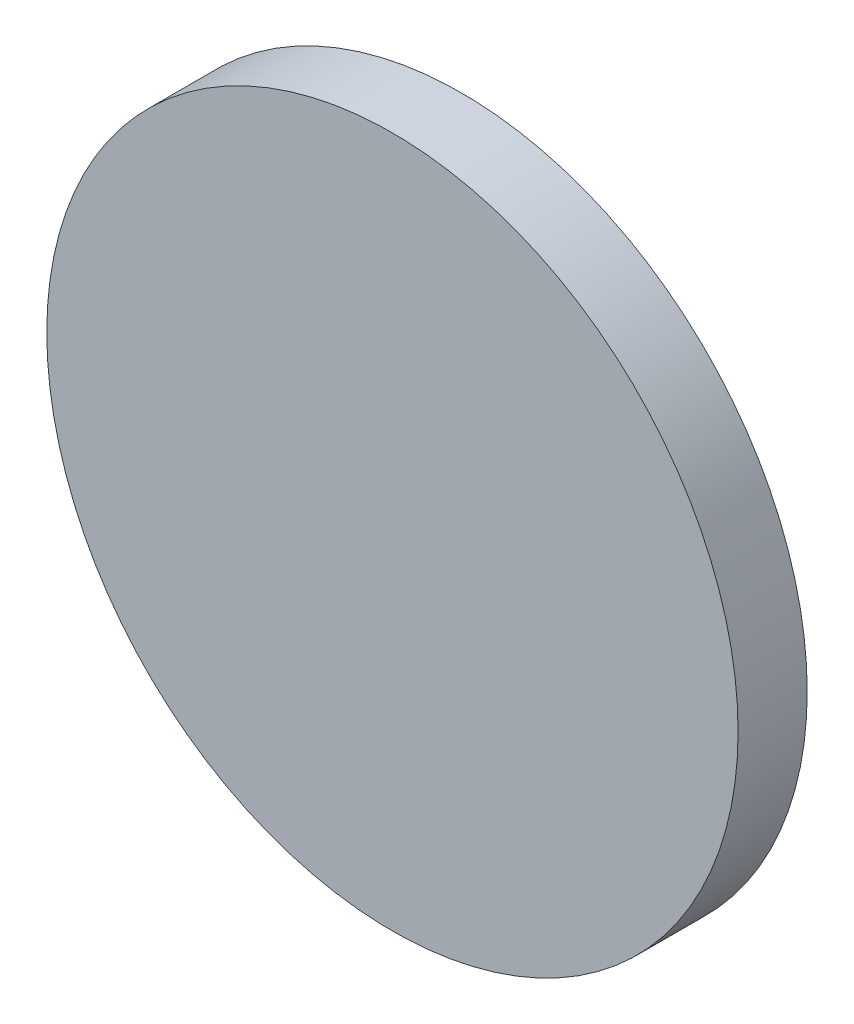
from build123d import *

# Parameters (mm, degrees)
SKETCH1_R           = 12.7
BOSS_EXTRUDE1_DEPTH = 2.54


with BuildPart() as part:
    # Sketch1 → Boss-Extrude1 (new body)
    with BuildSketch(Plane.XY):
        Circle(SKETCH1_R)
    extrude(amount=BOSS_EXTRUDE1_DEPTH)


solid = part.part
